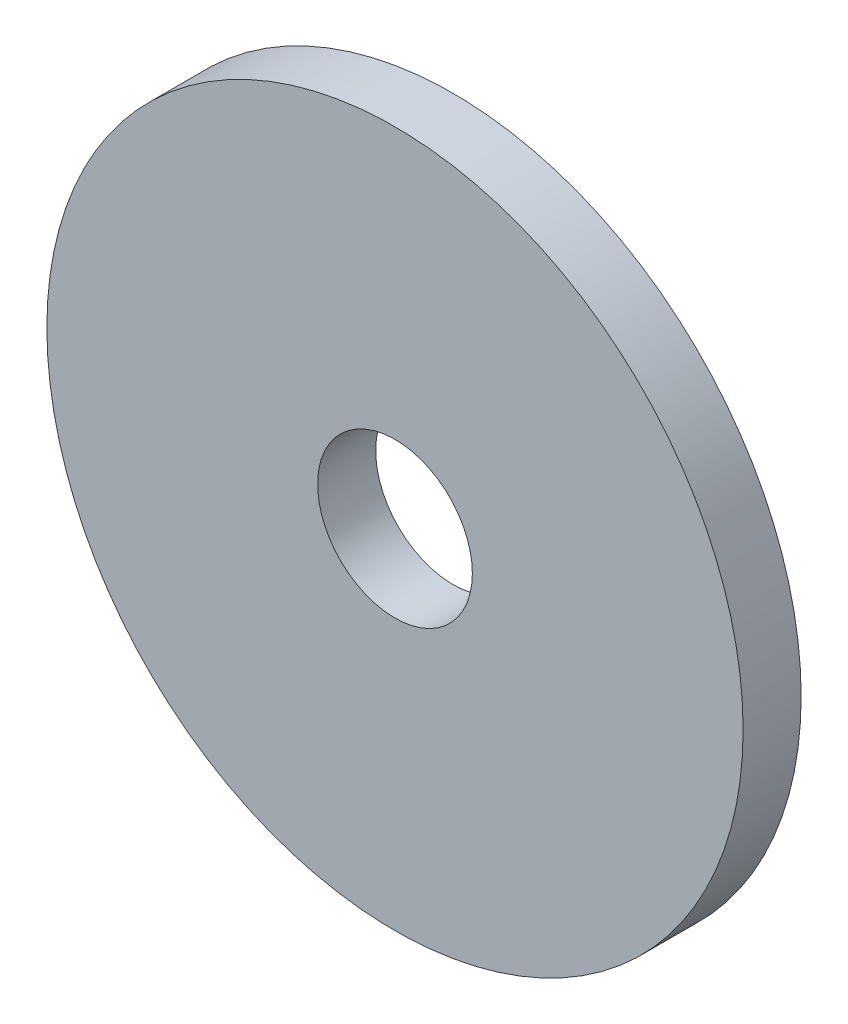
from build123d import *

# Parameters (mm, degrees)
SCHIZZO1_R                   = 18
SCHIZZO1_R_2                 = 4
ESTRUSIONE_ESTRUSIONE1_DEPTH = 3


with BuildPart() as part:
    # Schizzo1 → Estrusione-Estrusione1 (new body)
    with BuildSketch(Plane.XY):
        Circle(SCHIZZO1_R)
        Circle(SCHIZZO1_R_2, mode=Mode.SUBTRACT)
    extrude(amount=ESTRUSIONE_ESTRUSIONE1_DEPTH)


solid = part.part
